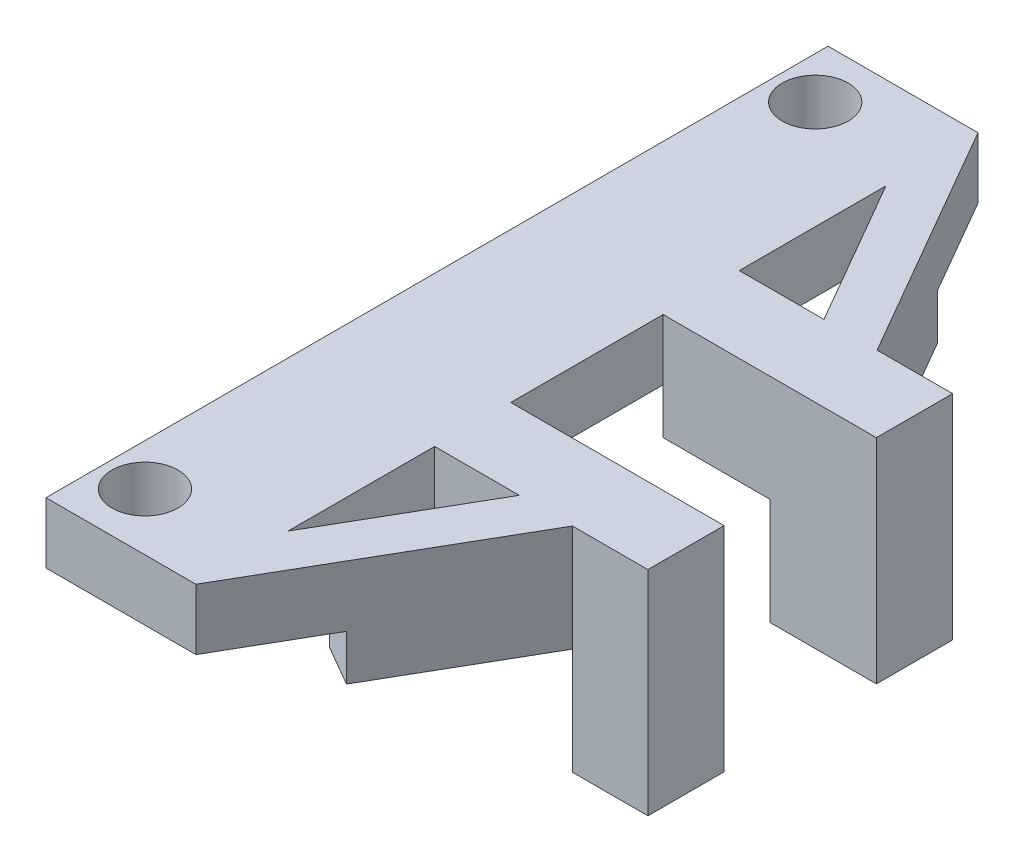
from build123d import *

# Parameters (mm, degrees)
SKETCH1_R           = 1.375
BOSS_EXTRUDE1_DEPTH = 2.54
BOSS_EXTRUDE3_DEPTH = 1.905
BOSS_EXTRUDE4_DEPTH = 6.35


with BuildPart() as part:
    # Sketch1 → Boss-Extrude1 (new body)
    with BuildSketch(Plane(origin=(0, 0, 0), x_dir=(1, 0, 0), z_dir=(0, 1, 0))):
        Polygon((4.5, 10.7505), (4.5, 17.1005), (13.39, 17.1005), (13.39, 20.2755), (10.244923854, 20.2755), (4.5, 30.226), (-1.75, 30.226), (-1.75, -2.375), (4.5, -2.375), (10.244923854, 7.5755), (13.39, 7.5755), (13.39, 10.7505), align=None)
        Polygon((4.5, 20.2755), (4.5, 26.38696584), (8.028456448, 20.2755), align=None, mode=Mode.SUBTRACT)
        Polygon((4.5, 7.5755), (8.028456448, 7.5755), (4.5, 1.46403416), align=None, mode=Mode.SUBTRACT)
        with Locations((0, 27.94)):
            Circle(SKETCH1_R, mode=Mode.SUBTRACT)
        Circle(SKETCH1_R, mode=Mode.SUBTRACT)
    extrude(amount=BOSS_EXTRUDE1_DEPTH)

    # Sketch1<3> → Boss-Extrude3 (add)
    with BuildSketch(Plane(origin=(0, 0, 0), x_dir=(1, 0, 0), z_dir=(0, 1, 0))):
        Polygon((10.244923854, 20.2755), (6.797350554, 26.246872117), (5.135, 25.287113577), (8.028456448, 20.2755), (4.5, 20.2755), (4.5, 17.1005), (13.39, 17.1005), (13.39, 20.2755), align=None)
        Polygon((4.5, 10.7505), (4.5, 7.5755), (8.028456448, 7.5755), (5.135, 2.563886423), (6.797350554, 1.604127883), (10.244923854, 7.5755), (13.39, 7.5755), (13.39, 10.7505), align=None)
    extrude(amount=-BOSS_EXTRUDE3_DEPTH)

    # Sketch1<4> → Boss-Extrude4 (add)
    with BuildSketch(Plane(origin=(0, 0, 0), x_dir=(1, 0, 0), z_dir=(0, 1, 0))):
        Polygon((13.39, 20.2755), (10.244923854, 20.2755), (10.607350554, 19.64775854), (8.945, 18.688), (8.945, 17.1005), (13.39, 17.1005), align=None)
        Polygon((13.39, 10.7505), (8.945, 10.7505), (8.945, 9.163), (10.607350554, 8.20324146), (10.244923854, 7.5755), (13.39, 7.5755), align=None)
    extrude(amount=-BOSS_EXTRUDE4_DEPTH)


solid = part.part
